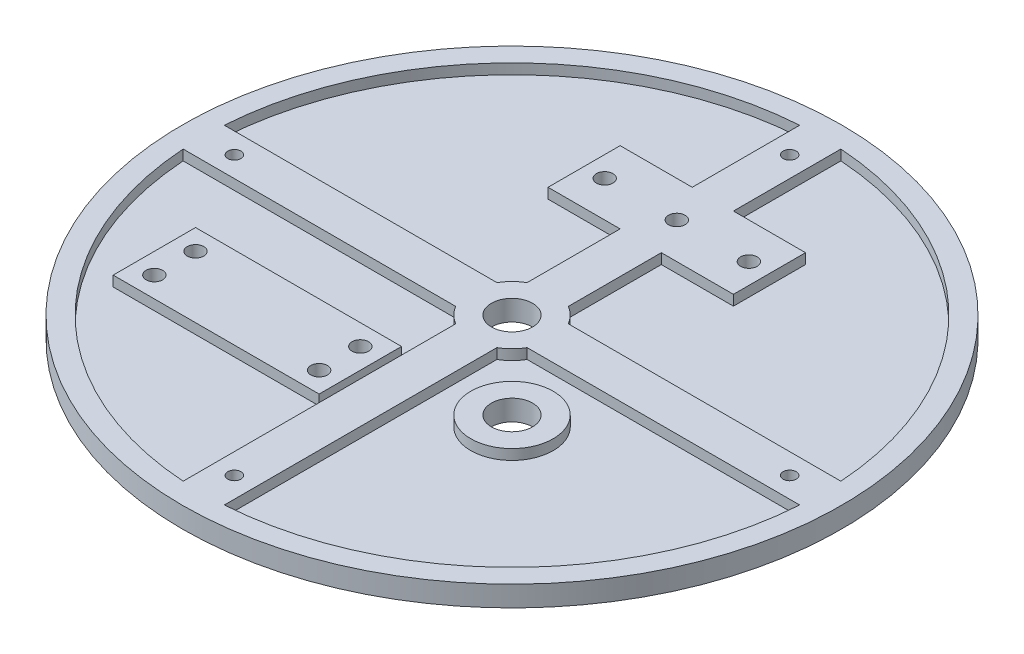
from build123d import *

# Parameters (mm, degrees)
SKETCH3_R                   = 101.6
BOSS_EXTRUDE1_DEPTH         = 6.35
SKETCH4_R                   = 6.35
CUT_EXTRUDE1_DEPTH          = 144.824345992
F_10_32_TAPPED_HOLE1_D      = 4.0386
F_10_32_TAPPED_HOLE1_DEPTH  = 13.716
F_10_32_TAPPED_HOLE1_TIP    = 1.213317848
SKETCH6_W                   = 63.5
SKETCH6_H                   = 25.4
SKETCH6_R                   = 12.7
CUT_EXTRUDE2_DEPTH          = 3.175
F_1_4_20_TAPPED_HOLE2_D     = 5.1054
F_1_4_20_TAPPED_HOLE2_DEPTH = 19.05
F_1_4_20_TAPPED_HOLE2_TIP   = 1.533816902
F_1_4_20_TAPPED_HOLE4_D     = 5.1054
F_1_4_20_TAPPED_HOLE4_DEPTH = 19.05
F_1_4_20_TAPPED_HOLE4_TIP   = 1.533816902


with BuildPart() as part:
    # Sketch3 → Boss-Extrude1 (new body)
    with BuildSketch(Plane(origin=(0, 0, 0), x_dir=(1, 0, 0), z_dir=(0, 1, 0))):
        with Locations(Location((0, 0, 0), (0, 0, 270))):
            Circle(SKETCH3_R)
    extrude(amount=BOSS_EXTRUDE1_DEPTH)

    # Sketch4 → Cut-Extrude1 (cut, through all)
    with BuildSketch(Plane(origin=(0, 6.35, 0), x_dir=(1, 0, 0), z_dir=(0, 1, 0))):
        with BuildLine():
            ThreePointArc((0, -6.35), (4.490128061, -4.490128061), (6.35, 0))
            Line((6.35, 0), (0, 0))
            Line((0, 0), (0, -6.35))
        make_face()
        with BuildLine():
            Line((0, 0), (6.35, 0))
            ThreePointArc((6.35, 0), (-4.490128061, 4.490128061), (0, -6.35))
            Line((0, -6.35), (0, 0))
        make_face()
        with Locations(Location((26.662380423, -26.662380423, 0), (0, 0, 270))):
            Circle(SKETCH4_R)
    extrude(amount=-CUT_EXTRUDE1_DEPTH, mode=Mode.SUBTRACT)

    # #10-32 Tapped Hole1
    with Locations(Plane(origin=(0, 6.35, -85.599778), x_dir=(0, 0, 1), z_dir=(0, 1, 0))):
        with Locations((0, 0), (85.599778, -85.599778), (171.199556, 0), (85.599778, 85.599778)):
            Hole(F_10_32_TAPPED_HOLE1_D / 2, depth=F_10_32_TAPPED_HOLE1_DEPTH)
            with Locations((0, 0, -(F_10_32_TAPPED_HOLE1_DEPTH + F_10_32_TAPPED_HOLE1_TIP / 2))):  # 118° drill point
                Cone(0, F_10_32_TAPPED_HOLE1_D / 2, F_10_32_TAPPED_HOLE1_TIP, mode=Mode.SUBTRACT)

    # Sketch6 → Cut-Extrude2 (cut)
    # profile 1 of 4: a face of its own
    with BuildSketch(Plane(origin=(0, 6.35, 0), x_dir=(1, 0, 0), z_dir=(0, 1, 0))):
        with BuildLine():
            Line((-28.575, 61.9125), (-6.35, 61.9125))
            Line((-6.35, 61.9125), (-6.35, 95.038097624))
            ThreePointArc((-6.35, 95.038097624), (-67.351920908, 67.351920908), (-95.038097624, 6.35))
            Line((-95.038097624, 6.35), (-10.998522628, 6.35))
            ThreePointArc((-10.998522628, 6.35), (-8.980256121, 8.980256121), (-6.35, 10.998522628))
            Line((-6.35, 10.998522628), (-6.35, 39.6875))
            Line((-6.35, 39.6875), (-28.575, 39.6875))
            Line((-28.575, 39.6875), (-28.575, 61.9125))
        make_face()
    # profile 2 of 4: a face of its own
    with BuildSketch(Plane(origin=(0, 6.35, 0), x_dir=(1, 0, 0), z_dir=(0, 1, 0))):
        with BuildLine():
            Line((6.35, 95.038097624), (6.35, 61.9125))
            Line((6.35, 61.9125), (28.575, 61.9125))
            Line((28.575, 61.9125), (28.575, 39.6875))
            Line((28.575, 39.6875), (6.35, 39.6875))
            Line((6.35, 39.6875), (6.35, 10.998522628))
            ThreePointArc((6.35, 10.998522628), (8.980256121, 8.980256121), (10.998522628, 6.35))
            Line((10.998522628, 6.35), (95.038097624, 6.35))
            ThreePointArc((95.038097624, 6.35), (67.351920908, 67.351920908), (6.35, 95.038097624))
        make_face()
    # profile 3 of 4: a face of its own
    with BuildSketch(Plane(origin=(0, 6.35, 0), x_dir=(1, 0, 0), z_dir=(0, 1, 0))):
        with BuildLine():
            ThreePointArc((-6.35, -10.998522628), (-8.980256121, -8.980256121), (-10.998522628, -6.35))
            Line((-10.998522628, -6.35), (-95.038097624, -6.35))
            ThreePointArc((-95.038097624, -6.35), (-67.351920908, -67.351920908), (-6.35, -95.038097624))
            Line((-6.35, -95.038097624), (-6.35, -10.998522628))
        make_face()
        with Locations((-40.4114, -38.1)):
            Rectangle(SKETCH6_W, SKETCH6_H, mode=Mode.SUBTRACT)
    # profile 4 of 4: a face of its own
    with BuildSketch(Plane(origin=(0, 6.35, 0), x_dir=(1, 0, 0), z_dir=(0, 1, 0))):
        with BuildLine():
            Line((95.038097624, -6.35), (10.998522628, -6.35))
            ThreePointArc((10.998522628, -6.35), (8.980256121, -8.980256121), (6.35, -10.998522628))
            Line((6.35, -10.998522628), (6.35, -95.038097624))
            ThreePointArc((6.35, -95.038097624), (67.351920908, -67.351920908), (95.038097624, -6.35))
        make_face()
        with Locations(Location((26.662380423, -26.662380423, 0), (0, 0, 270))):
            Circle(SKETCH6_R, mode=Mode.SUBTRACT)
    extrude(amount=-CUT_EXTRUDE2_DEPTH, mode=Mode.SUBTRACT)

    # 1/4-20 Tapped Hole2
    with Locations(Plane(origin=(-22.225, 6.35, -50.8), x_dir=(0, 0, 1), z_dir=(0, 1, 0))):
        with Locations((0, 0), (0, 44.45), (0, 22.225)):
            Hole(F_1_4_20_TAPPED_HOLE2_D / 2, depth=F_1_4_20_TAPPED_HOLE2_DEPTH)
            with Locations((0, 0, -(F_1_4_20_TAPPED_HOLE2_DEPTH + F_1_4_20_TAPPED_HOLE2_TIP / 2))):  # 118° drill point
                Cone(0, F_1_4_20_TAPPED_HOLE2_D / 2, F_1_4_20_TAPPED_HOLE2_TIP, mode=Mode.SUBTRACT)

    # 1/4-20 Tapped Hole4
    with Locations(Plane(origin=(-65.8114, 6.35, 31.75), x_dir=(0, 0, 1), z_dir=(0, 1, 0))):
        with Locations((0, 0), (12.7, 0), (12.7, 50.8), (0, 50.8)):
            Hole(F_1_4_20_TAPPED_HOLE4_D / 2, depth=F_1_4_20_TAPPED_HOLE4_DEPTH)
            with Locations((0, 0, -(F_1_4_20_TAPPED_HOLE4_DEPTH + F_1_4_20_TAPPED_HOLE4_TIP / 2))):  # 118° drill point
                Cone(0, F_1_4_20_TAPPED_HOLE4_D / 2, F_1_4_20_TAPPED_HOLE4_TIP, mode=Mode.SUBTRACT)


solid = part.part
